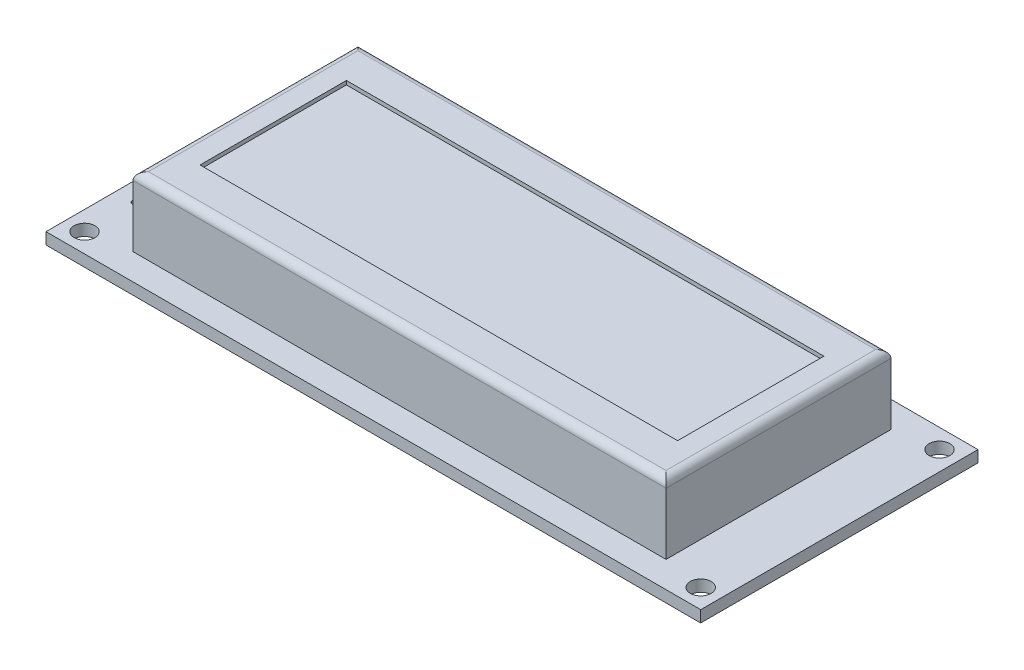
from build123d import *

# Parameters (mm, degrees)
SKETCH_1_W                  = 85
SKETCH_1_H                  = 36
EXTRUDE_1_DEPTH             = 1.5
SKETCH_2_W                  = 69.2
SKETCH_2_H                  = 29.2
EXTRUDE_2_DEPTH             = 9
CUT_EXTRUDE_1_REACH         = 49.024
SKETCH_3_R                  = 1.35
SKETCH_4_W                  = 62
SKETCH_4_H                  = 19
CUT_EXTRUDE_2_DEPTH         = 0.5
FILLET_1_R                  = 1
CUT_EXTRUDE_3_REACH         = 49.024
SKETCH_5_R                  = 0.4
PATTERN_LINEAR_1_COUNT      = 8
PATTERN_LINEAR_1_PITCH      = 2.54
PATTERN_LINEAR_1_COUNT_DIR2 = 2
PATTERN_LINEAR_1_PITCH_DIR2 = 2.54


with BuildPart() as part:
    # Эскиз1 → Бобышка-Вытянуть1 (new body)
    with BuildSketch(Plane(origin=(0, 0, 0), x_dir=(1, 0, 0), z_dir=(0, 1, 0))):
        Rectangle(SKETCH_1_W, SKETCH_1_H)
    extrude(amount=EXTRUDE_1_DEPTH)

    # Эскиз2 → Бобышка-Вытянуть2 (add)
    with BuildSketch(Plane(origin=(0, 1.5, 0), x_dir=(1, 0, 0), z_dir=(0, 1, 0))):
        Rectangle(SKETCH_2_W, SKETCH_2_H)
    extrude(amount=EXTRUDE_2_DEPTH)

    # Эскиз3 → Вырез-Вытянуть1 (cut, up to next)
    with BuildSketch(Plane(origin=(0, 1.5, 0), x_dir=(1, 0, 0), z_dir=(0, 1, 0)), mode=Mode.PRIVATE) as cut_extrude_1_sk1:
        with Locations(Location((-40, 15.5, 0), (0, 0, 270))):
            Circle(SKETCH_3_R)
    cut_extrude_1_tool1 = extrude(cut_extrude_1_sk1.sketch, amount=-CUT_EXTRUDE_1_REACH, mode=Mode.PRIVATE) & part.part
    # Эскиз3 → Вырез-Вытянуть1 (cut, up to next)
    with BuildSketch(Plane(origin=(0, 1.5, 0), x_dir=(1, 0, 0), z_dir=(0, 1, 0)), mode=Mode.PRIVATE) as cut_extrude_1_sk2:
        with Locations(Location((-40, -15.5, 0), (0, 0, 90))):
            Circle(SKETCH_3_R)
    cut_extrude_1_tool2 = extrude(cut_extrude_1_sk2.sketch, amount=-CUT_EXTRUDE_1_REACH, mode=Mode.PRIVATE) & part.part
    # Эскиз3 → Вырез-Вытянуть1 (cut, up to next)
    with BuildSketch(Plane(origin=(0, 1.5, 0), x_dir=(1, 0, 0), z_dir=(0, 1, 0)), mode=Mode.PRIVATE) as cut_extrude_1_sk3:
        with Locations(Location((40, -15.5, 0), (0, 0, 270))):
            Circle(SKETCH_3_R)
    cut_extrude_1_tool3 = extrude(cut_extrude_1_sk3.sketch, amount=-CUT_EXTRUDE_1_REACH, mode=Mode.PRIVATE) & part.part
    # Эскиз3 → Вырез-Вытянуть1 (cut, up to next)
    with BuildSketch(Plane(origin=(0, 1.5, 0), x_dir=(1, 0, 0), z_dir=(0, 1, 0)), mode=Mode.PRIVATE) as cut_extrude_1_sk4:
        with Locations(Location((40, 15.5, 0), (0, 0, 90))):
            Circle(SKETCH_3_R)
    cut_extrude_1_tool4 = extrude(cut_extrude_1_sk4.sketch, amount=-CUT_EXTRUDE_1_REACH, mode=Mode.PRIVATE) & part.part
    add(cut_extrude_1_tool1.solids().sort_by_distance((-40, 1.5, -15.5))[0], mode=Mode.SUBTRACT)
    add(cut_extrude_1_tool2.solids().sort_by_distance((-40, 1.5, 15.5))[0], mode=Mode.SUBTRACT)
    add(cut_extrude_1_tool3.solids().sort_by_distance((40, 1.5, 15.5))[0], mode=Mode.SUBTRACT)
    add(cut_extrude_1_tool4.solids().sort_by_distance((40, 1.5, -15.5))[0], mode=Mode.SUBTRACT)

    # Эскиз4 → Вырез-Вытянуть2 (cut)
    with BuildSketch(Plane(origin=(0, 10.5, 0), x_dir=(1, 0, 0), z_dir=(0, 1, 0))):
        Rectangle(SKETCH_4_W, SKETCH_4_H)
    extrude(amount=-CUT_EXTRUDE_2_DEPTH, mode=Mode.SUBTRACT)

    # Скругление1
    fillet_1_edges = [part.edges().sort_by_distance(p)[0] for p in [
        (34.6, 10.5, 0),
        (0, 10.5, -14.6),
        (-34.6, 10.5, 0),
        (0, 10.5, 14.6),
    ]]
    fillet(fillet_1_edges, radius=FILLET_1_R)

    # Эскиз5 → Вырез-Вытянуть3 (cut, up to next)
    with BuildSketch(Plane(origin=(0, 1.5, 0), x_dir=(1, 0, 0), z_dir=(0, 1, 0)), mode=Mode.PRIVATE) as cut_extrude_3_sk1:
        with Locations(Location((-40, 8.89, 0), (0, 0, 270))):
            Circle(SKETCH_5_R)
    cut_extrude_3_tool1 = extrude(cut_extrude_3_sk1.sketch, amount=-CUT_EXTRUDE_3_REACH, mode=Mode.PRIVATE) & part.part
    cut_extrude_3 = cut_extrude_3_tool1.solids().sort_by_distance((-40, 1.5, -8.89))[0]
    add(cut_extrude_3, mode=Mode.SUBTRACT)

    # Линейный массив1: Cut-Extrude 3 8 × 2
    with Locations(*[(j * PATTERN_LINEAR_1_PITCH_DIR2, 0, i * PATTERN_LINEAR_1_PITCH) for i in range(PATTERN_LINEAR_1_COUNT) for j in range(PATTERN_LINEAR_1_COUNT_DIR2) if (i, j) != (0, 0)]):
        add(cut_extrude_3, mode=Mode.SUBTRACT)


solid = part.part
